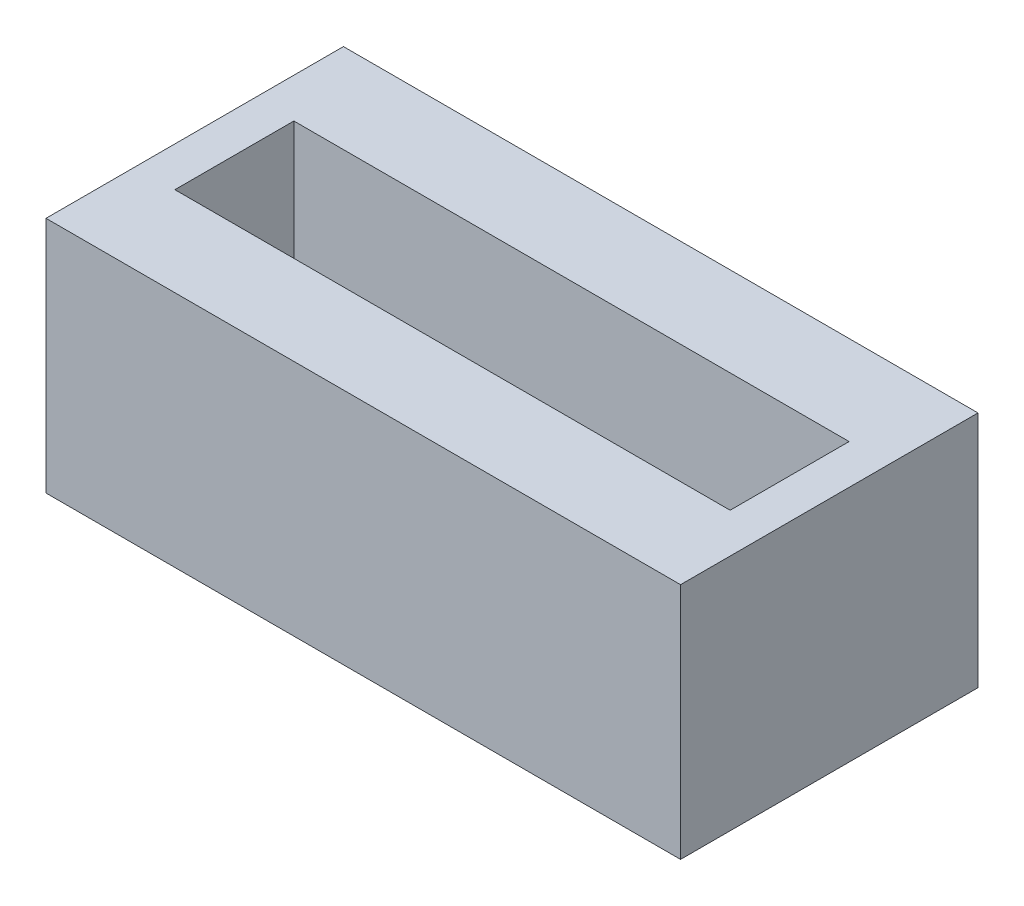
from build123d import *

# Parameters (mm, degrees)
SKETCH1_W           = 32
SKETCH1_H           = 15
BOSS_EXTRUDE1_DEPTH = 12
SKETCH1_3_W         = 28
SKETCH1_3_H         = 6
CUT_EXTRUDE1_DEPTH  = 12


with BuildPart() as part:
    # Sketch1 → Boss-Extrude1 (new body)
    with BuildSketch(Plane(origin=(0, 0, 0), x_dir=(1, 0, 0), z_dir=(0, 1, 0))):
        Rectangle(SKETCH1_W, SKETCH1_H)
    extrude(amount=BOSS_EXTRUDE1_DEPTH)

    # Sketch1<3> → Cut-Extrude1 (cut)
    with BuildSketch(Plane(origin=(0, 0, 0), x_dir=(1, 0, 0), z_dir=(0, 1, 0))):
        Rectangle(SKETCH1_3_W, SKETCH1_3_H)
    extrude(amount=CUT_EXTRUDE1_DEPTH, mode=Mode.SUBTRACT)


solid = part.part
